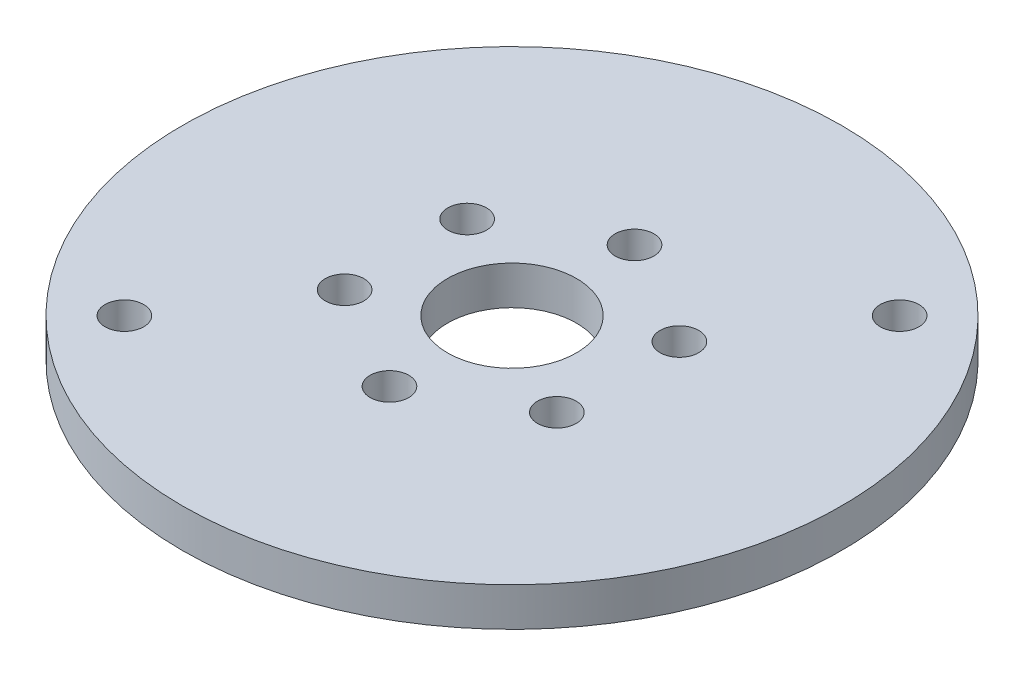
from build123d import *

# Parameters (mm, degrees)
SKETCH1_R           = 25.55
SKETCH1_R_2         = 1.5
SKETCH1_R_3         = 5
BOSS_EXTRUDE1_DEPTH = 3


with BuildPart() as part:
    # Sketch1 → Boss-Extrude1 (new body)
    with BuildSketch(Plane(origin=(0, 0, 0), x_dir=(1, 0, 0), z_dir=(0, 1, 0))):
        with Locations(Location((0, 0, 0), (0, 0, 270))):
            Circle(SKETCH1_R)
        with Locations(Location((15.0260191, 15.0260191, 0), (0, 0, 270))):
            Circle(SKETCH1_R_2, mode=Mode.SUBTRACT)
        with Locations(Location((-15.0260191, -15.0260191, 0), (0, 0, 270))):
            Circle(SKETCH1_R_2, mode=Mode.SUBTRACT)
        with Locations(Location((0, 0, 0), (0, 0, 270))):
            Circle(SKETCH1_R_3, mode=Mode.SUBTRACT)
        with Locations(Location((0, 9.5, 0), (0, 0, 270))):
            Circle(SKETCH1_R_2, mode=Mode.SUBTRACT)
        with Locations(Location((8.227241336, 4.75, 0), (0, 0, 270))):
            Circle(SKETCH1_R_2, mode=Mode.SUBTRACT)
        with Locations(Location((8.227241336, -4.75, 0), (0, 0, 270))):
            Circle(SKETCH1_R_2, mode=Mode.SUBTRACT)
        with Locations(Location((0, -9.5, 0), (0, 0, 270))):
            Circle(SKETCH1_R_2, mode=Mode.SUBTRACT)
        with Locations(Location((-8.227241336, -4.75, 0), (0, 0, 270))):
            Circle(SKETCH1_R_2, mode=Mode.SUBTRACT)
        with Locations(Location((-8.227241336, 4.75, 0), (0, 0, 270))):
            Circle(SKETCH1_R_2, mode=Mode.SUBTRACT)
    extrude(amount=BOSS_EXTRUDE1_DEPTH)


solid = part.part
